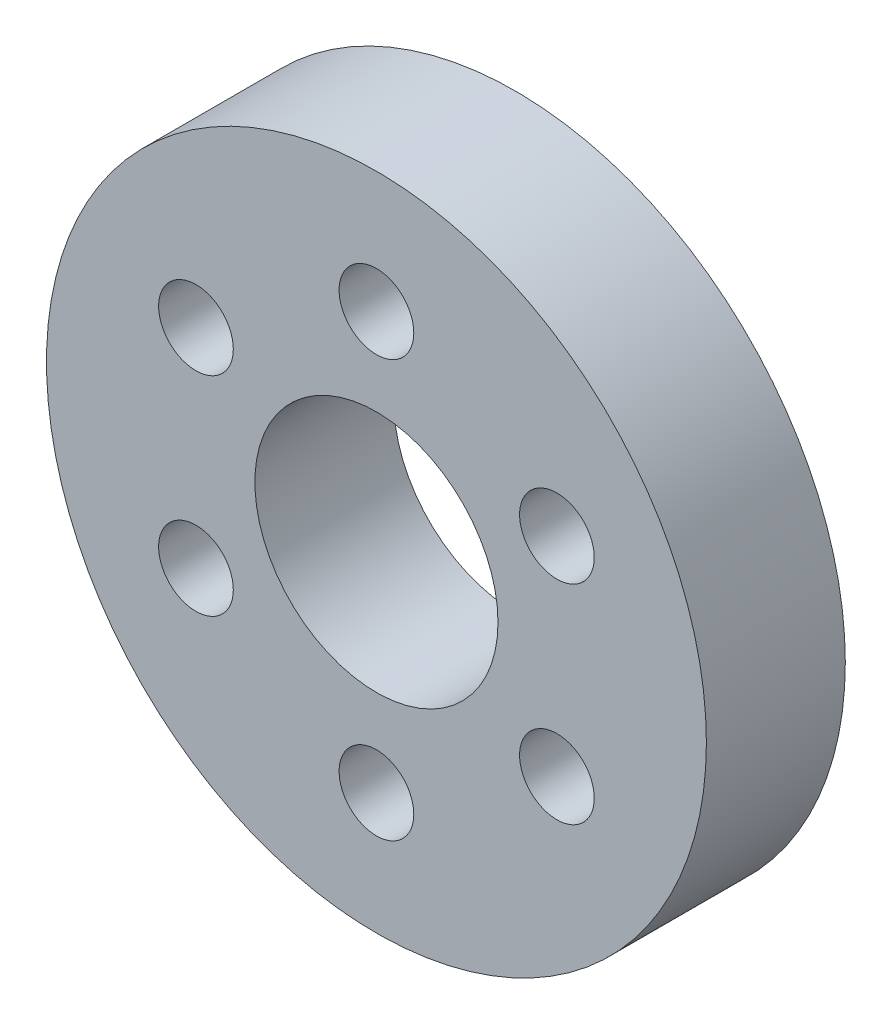
from build123d import *

# Parameters (mm, degrees)
SKETCH_1_R      = 19
SKETCH_1_R_2    = 7
SKETCH_1_R_3    = 2.15
EXTRUDE_1_DEPTH = 8


with BuildPart() as part:
    # 草图1 → 凸台-拉伸1 (new body)
    with BuildSketch(Plane.XY):
        with Locations((0, -1.487354696)):
            Circle(SKETCH_1_R)
        with Locations((0, -1.487354696)):
            Circle(SKETCH_1_R_2, mode=Mode.SUBTRACT)
        with Locations((0, 10.512645304)):
            Circle(SKETCH_1_R_3, mode=Mode.SUBTRACT)
        with Locations((10.392304845, 4.512645304)):
            Circle(SKETCH_1_R_3, mode=Mode.SUBTRACT)
        with Locations((10.392304845, -7.487354696)):
            Circle(SKETCH_1_R_3, mode=Mode.SUBTRACT)
        with Locations((0, -13.487354696)):
            Circle(SKETCH_1_R_3, mode=Mode.SUBTRACT)
        with Locations((-10.392304845, -7.487354696)):
            Circle(SKETCH_1_R_3, mode=Mode.SUBTRACT)
        with Locations((-10.392304845, 4.512645304)):
            Circle(SKETCH_1_R_3, mode=Mode.SUBTRACT)
    extrude(amount=EXTRUDE_1_DEPTH)


solid = part.part
